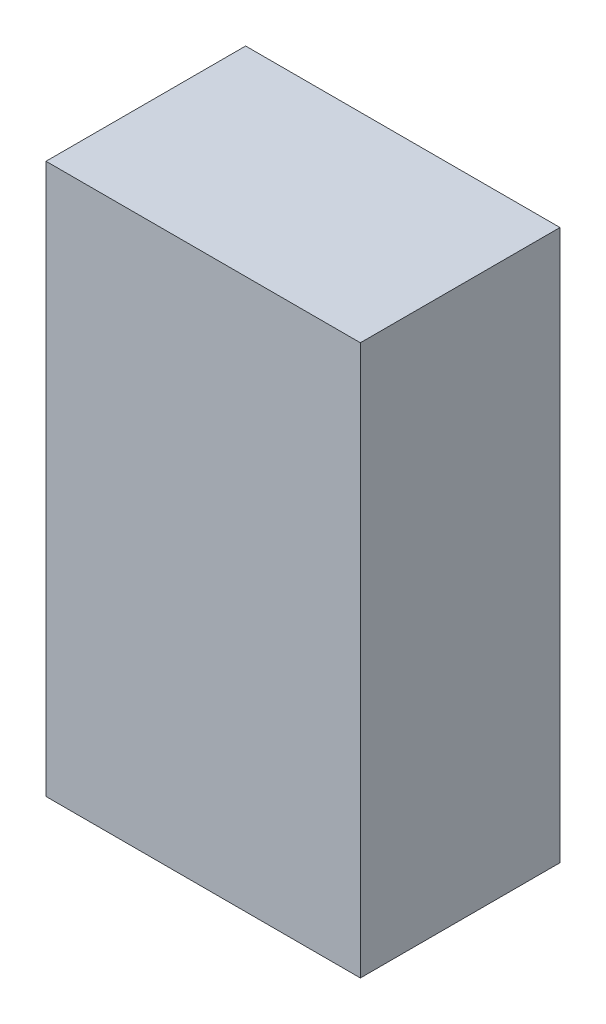
from build123d import *

# Parameters (mm, degrees)
SKETCH1_W           = 20
SKETCH1_H           = 35
BOSS_EXTRUDE1_DEPTH = 12.7


with BuildPart() as part:
    # Sketch1 → Boss-Extrude1 (new body)
    with BuildSketch(Plane.XY):
        with Locations((10, -17.5)):
            Rectangle(SKETCH1_W, SKETCH1_H)
    extrude(amount=BOSS_EXTRUDE1_DEPTH)


solid = part.part
